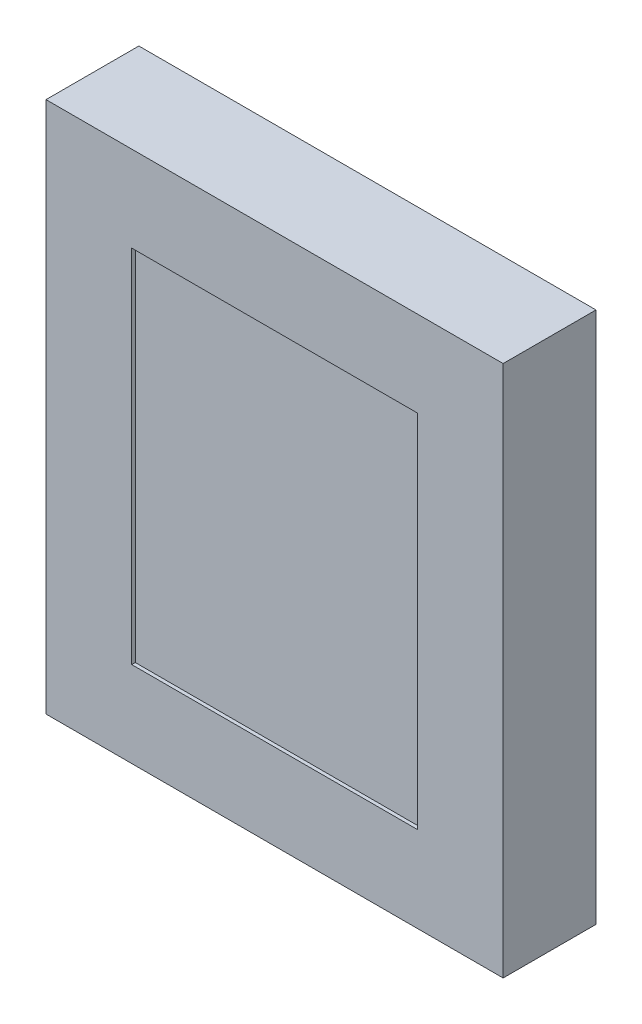
from build123d import *

# Parameters (mm, degrees)
RESSALTO_EXTRUS_O1_DEPTH      = 60
RESSALTO_EXTRUS_O1_DEPTH_BACK = 60
ESBO_O1_W                     = 400
ESBO_O1_H                     = 505
RESSALTO_EXTRUS_O2_DEPTH      = 65
RESSALTO_EXTRUS_O2_DEPTH_BACK = 65
ESBO_O2_W                     = 640
ESBO_O2_H                     = 745
ESBO_O2_W_2                   = 400
ESBO_O2_H_2                   = 505


with BuildPart() as part:
    # Esboço1 → Ressalto-extrusão1 (new, two sides: drawn at the far end of the back side and taken through both)
    with BuildSketch(Plane.XY.offset(-RESSALTO_EXTRUS_O1_DEPTH_BACK)):
        Rectangle(ESBO_O1_W, ESBO_O1_H)
    extrude(amount=RESSALTO_EXTRUS_O1_DEPTH + RESSALTO_EXTRUS_O1_DEPTH_BACK)


with BuildPart() as body_2:
    # Esboço2 → Ressalto-extrusão2 (new, two sides: drawn at the far end of the back side and taken through both)
    with BuildSketch(Plane.XY.offset(-RESSALTO_EXTRUS_O2_DEPTH_BACK)):
        Rectangle(ESBO_O2_W, ESBO_O2_H)
        Rectangle(ESBO_O2_W_2, ESBO_O2_H_2, mode=Mode.SUBTRACT)
    extrude(amount=RESSALTO_EXTRUS_O2_DEPTH + RESSALTO_EXTRUS_O2_DEPTH_BACK)


solid = Compound([part.part, body_2.part])
